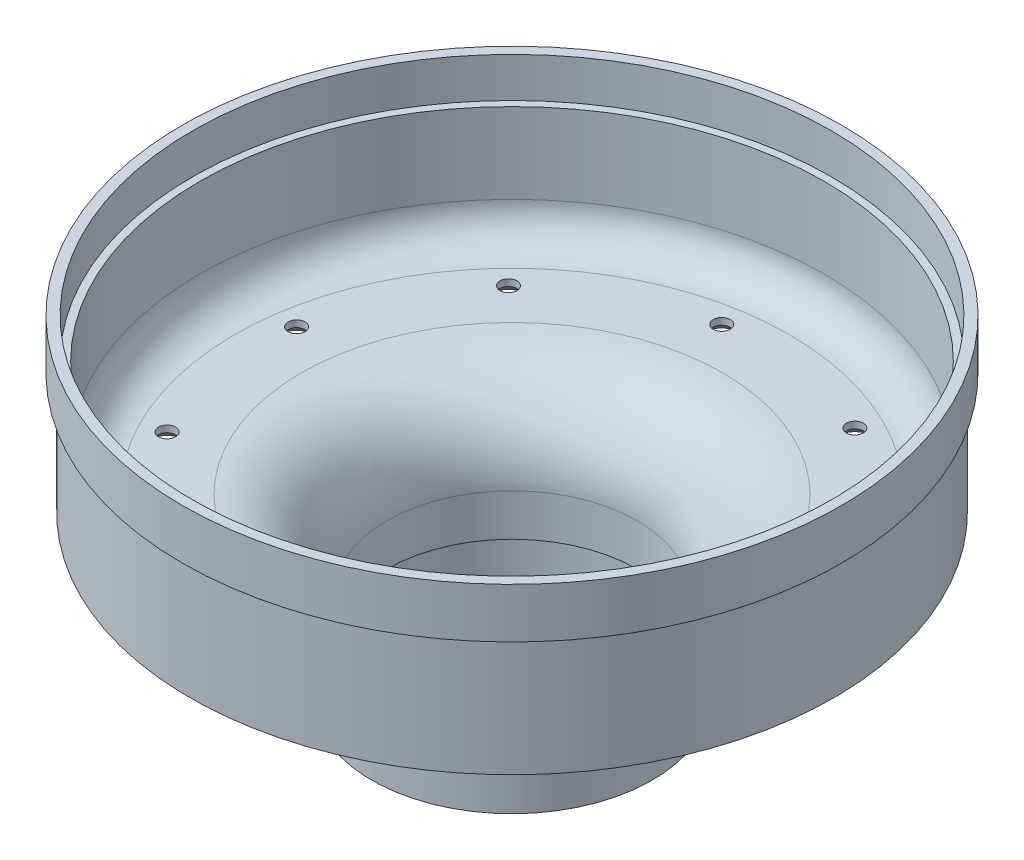
from build123d import *

# Parameters (mm, degrees)
M3_ALT_GEN_ALYAN_HAV_A_BA_L_K_R_VIDA_I_D           = 3.4
M3_ALT_GEN_ALYAN_HAV_A_BA_L_K_R_VIDA_I_CSINK_D     = 6.72
M3_ALT_GEN_ALYAN_HAV_A_BA_L_K_R_VIDA_I_CSINK_ANGLE = 90
DAIRESEL_KAPLAMA2_COUNT                            = 10


with BuildPart() as part:
    # Çizim1 → Döndür3 (revolve)
    with BuildSketch(Plane.XY, mode=Mode.PRIVATE) as d_nd_r3_sk:
        with BuildLine():
            Line((-26.6, 0.54574792), (-26.6, 10.54574792))
            Line((-26.6, 10.54574792), (-25.1, 10.54574792))
            Line((-25.1, 10.54574792), (-25.1, 18.94574792))
            ThreePointArc((-25.1, 18.94574792), (-30.108474042, 31.037273878), (-42.2, 36.04574792))
            Line((-42.2, 36.04574792), (-55.5, 36.04574792))
            ThreePointArc((-55.5, 36.04574792), (-60.449747468, 38.096000452), (-62.5, 43.04574792))
            Line((-62.5, 43.04574792), (-62.5, 59.129332396))
            Line((-62.5, 59.129332396), (-64, 59.129332396))
            Line((-64, 59.129332396), (-64, 67.129332396))
            Line((-64, 67.129332396), (-66, 67.129332396))
            Line((-66, 67.129332396), (-66, 57.129332396))
            Line((-66, 57.129332396), (-64.5, 57.129332396))
            Line((-64.5, 57.129332396), (-64.5, 33.04574792))
            Line((-64.5, 33.04574792), (-39.98, 33.04574792))
            ThreePointArc((-39.98, 33.04574792), (-31.57957144, 29.56617648), (-28.1, 21.16574792))
            Line((-28.1, 21.16574792), (-28.1, 0.54574792))
            Line((-28.1, 0.54574792), (-26.6, 0.54574792))
        make_face()
    revolve(d_nd_r3_sk.sketch.rotate(Axis((0, 0, 0), (0, 1, 0)), 270), axis=Axis((0, 0, 0), (0, 1, 0)))

    # M3 Altıgen Alyan Havşa Başlı Kör Vida İçin Havşa4 (through all)
    with Locations(Plane(origin=(8.5, 33.04574792, 50.5), x_dir=(0, 0, -1), z_dir=(0, -1, 0))):
        with Locations((0, 0)):
            m3_alt_gen_alyan_hav_a_ba_l_k_r_vida_i = CounterSinkHole(M3_ALT_GEN_ALYAN_HAV_A_BA_L_K_R_VIDA_I_D / 2, M3_ALT_GEN_ALYAN_HAV_A_BA_L_K_R_VIDA_I_CSINK_D / 2, counter_sink_angle=M3_ALT_GEN_ALYAN_HAV_A_BA_L_K_R_VIDA_I_CSINK_ANGLE)

    # Dairesel Kaplama2: M3 Altıgen Alyan Havşa Başlı Kör Vida İçin Havşa4 ×10 about axis
    dairesel_kaplama2_axis = Axis((0, 0, 0), (0, 1, 0))
    for i in range(1, DAIRESEL_KAPLAMA2_COUNT):
        add(m3_alt_gen_alyan_hav_a_ba_l_k_r_vida_i.rotate(dairesel_kaplama2_axis, i * 360 / DAIRESEL_KAPLAMA2_COUNT), mode=Mode.SUBTRACT)


solid = part.part
